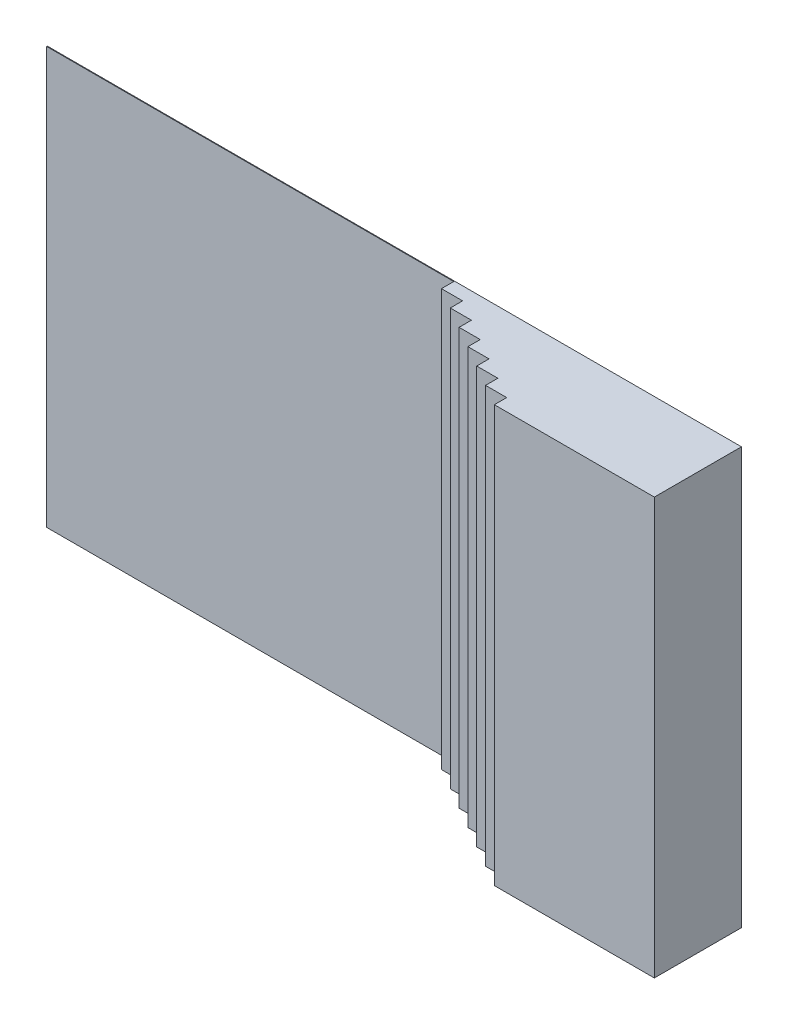
from build123d import *

# Parameters (mm, degrees)
SKETCH1_W           = 10000
SKETCH1_H           = 6000
BOSS_EXTRUDE1_DEPTH = 10
BOSS_EXTRUDE2_DEPTH = 6000


with BuildPart() as part:
    # Sketch1 → Boss-Extrude1 (new body)
    with BuildSketch(Plane.XY):
        with Locations((2500, 0)):
            Rectangle(SKETCH1_W, SKETCH1_H)
    extrude(amount=-BOSS_EXTRUDE1_DEPTH)

    # Sketch2 → Boss-Extrude2 (add)
    with BuildSketch(Plane.XZ.offset(3000)):
        Polygon((3366.4, 0), (3366.4, 177.8), (3671.2, 177.8), (3671.2, 355.6), (3976, 355.6), (3976, 533.4), (4280.8, 533.4), (4280.8, 711.2), (4585.6, 711.2), (4585.6, 889), (4890.4, 889), (4890.4, 1066.8), (5195.2, 1066.8), (5195.2, 1244.6), (5500, 1244.6), (7500, 1244.6), (7500, 0), align=None)
    extrude(amount=-BOSS_EXTRUDE2_DEPTH)


solid = part.part
